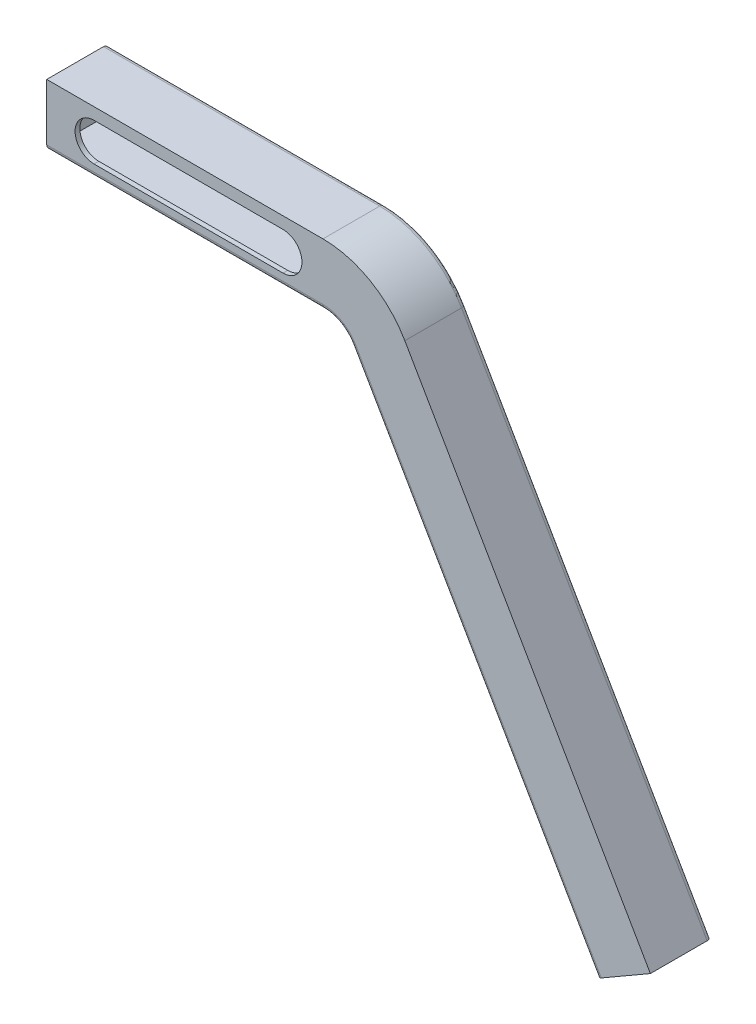
from build123d import *

# Parameters (mm, degrees)
BOSS_EXTRUDE1_DEPTH = 33.02
SHELL1_T            = -2.54
CUT_EXTRUDE1_REACH  = 409.111
SKETCH2_W           = 27.94
SKETCH2_H           = 27.94
CUT_EXTRUDE2_DEPTH  = 2.54
CUT_EXTRUDE3_REACH  = 303.28
CUT_EXTRUDE4_REACH  = 303.28
SKETCH6_R           = 6.35
CUT_EXTRUDE5_REACH  = 303.28
SKETCH7_R           = 6.35
SKETCH8_W           = 27.94
SKETCH8_H           = 27.94
BOSS_EXTRUDE2_DEPTH = 2.54
FILLET1_R           = 2.54


with BuildPart() as part:
    # Sketch1 → Boss-Extrude1 (new body)
    with BuildSketch(Plane.XY):
        with BuildLine():
            Line((-172.046968374, 25.4), (-23.576362049, 25.4))
            ThreePointArc((-23.576362049, 25.4), (1.823637951, 18.594090512), (20.417728463, 0))
            Line((20.417728463, 0), (152.4, -228.6))
            Line((152.4, -228.6), (123.803841167, -245.11))
            Line((123.803841167, -245.11), (-8.17843037, -16.51))
            ThreePointArc((-8.17843037, -16.51), (-14.686362049, -10.002068321), (-23.576362049, -7.62))
            Line((-23.576362049, -7.62), (-172.046968374, -7.62))
            Line((-172.046968374, -7.62), (-172.046968374, 25.4))
        make_face()
    extrude(amount=BOSS_EXTRUDE1_DEPTH)

    # Shell1
    shell1_openings = [part.faces().sort_by_distance(p)[0] for p in [
        (-172.046968374, 8.89, 16.51),
    ]]
    offset(amount=SHELL1_T, openings=shell1_openings, kind=Kind.INTERSECTION)

    # Sketch2 → Cut-Extrude1 (cut, up to next)
    with BuildSketch(Plane(origin=(137.086703653, -237.441135768, 0), x_dir=(0.8660254037844406, 0.4999999999999967, 0), z_dir=(0.4999999999999967, -0.8660254037844406, 0)), mode=Mode.PRIVATE) as cut_extrude1_sk1:
        with Locations((1.172271537, 16.51)):
            Rectangle(SKETCH2_W, SKETCH2_H)
    cut_extrude1_tool1 = extrude(cut_extrude1_sk1.sketch, amount=-CUT_EXTRUDE1_REACH, mode=Mode.PRIVATE) & part.part
    add(cut_extrude1_tool1.solids().sort_by_distance((138.101921, -236.855, 16.51))[0], mode=Mode.SUBTRACT)

    # Sketch3 → Cut-Extrude2 (cut)
    with BuildSketch(Plane.XY.offset(33.02)):
        with BuildLine():
            Line((-146.646968374, 19.05), (-45.046968374, 19.05))
            ThreePointArc((-45.046968374, 19.05), (-34.886968374, 8.89), (-45.046968374, -1.27))
            Line((-45.046968374, -1.27), (-50.126968374, -1.27))
            Line((-50.126968374, -1.27), (-146.646968374, -1.27))
            ThreePointArc((-146.646968374, -1.27), (-156.806968374, 8.89), (-146.646968374, 19.05))
        make_face()
    extrude(amount=-CUT_EXTRUDE2_DEPTH, mode=Mode.SUBTRACT)

    # Sketch4 → Cut-Extrude3 (cut, up to next)
    with BuildSketch(Plane(origin=(0, 0, 0), x_dir=(-1, 0, 0), z_dir=(0, 0, -1)), mode=Mode.PRIVATE) as cut_extrude3_sk1:
        with BuildLine():
            Line((45.046968374, -1.27), (146.646968374, -1.27))
            ThreePointArc((146.646968374, -1.27), (156.806968374, 8.89), (146.646968374, 19.05))
            Line((146.646968374, 19.05), (45.046968374, 19.05))
            ThreePointArc((45.046968374, 19.05), (34.886968374, 8.89), (45.046968374, -1.27))
        make_face()
    cut_extrude3_tool1 = extrude(cut_extrude3_sk1.sketch, amount=-CUT_EXTRUDE3_REACH, mode=Mode.PRIVATE) & part.part
    add(cut_extrude3_tool1.solids().sort_by_distance((-95.846968, 8.89, 0))[0], mode=Mode.SUBTRACT)

    # Sketch6 → Cut-Extrude4 (cut, up to next)
    with BuildSketch(Plane(origin=(0, 0, 0), x_dir=(-1, 0, 0), z_dir=(0, 0, -1)), mode=Mode.PRIVATE) as cut_extrude4_sk1:
        with Locations((-116.511920584, -199.460023065)):
            Circle(SKETCH6_R)
    cut_extrude4_tool1 = extrude(cut_extrude4_sk1.sketch, amount=-CUT_EXTRUDE4_REACH, mode=Mode.PRIVATE) & part.part
    # Sketch6 → Cut-Extrude4 (cut, up to next)
    with BuildSketch(Plane(origin=(0, 0, 0), x_dir=(-1, 0, 0), z_dir=(0, 0, -1)), mode=Mode.PRIVATE) as cut_extrude4_sk2:
        with Locations((-107.621920584, -184.062091385)):
            Circle(SKETCH6_R)
    cut_extrude4_tool2 = extrude(cut_extrude4_sk2.sketch, amount=-CUT_EXTRUDE4_REACH, mode=Mode.PRIVATE) & part.part
    # Sketch6 → Cut-Extrude4 (cut, up to next)
    with BuildSketch(Plane(origin=(0, 0, 0), x_dir=(-1, 0, 0), z_dir=(0, 0, -1)), mode=Mode.PRIVATE) as cut_extrude4_sk3:
        with Locations((-98.731920584, -168.664159706)):
            Circle(SKETCH6_R)
    cut_extrude4_tool3 = extrude(cut_extrude4_sk3.sketch, amount=-CUT_EXTRUDE4_REACH, mode=Mode.PRIVATE) & part.part
    # Sketch6 → Cut-Extrude4 (cut, up to next)
    with BuildSketch(Plane(origin=(0, 0, 0), x_dir=(-1, 0, 0), z_dir=(0, 0, -1)), mode=Mode.PRIVATE) as cut_extrude4_sk4:
        with Locations((-89.841920584, -153.266228027)):
            Circle(SKETCH6_R)
    cut_extrude4_tool4 = extrude(cut_extrude4_sk4.sketch, amount=-CUT_EXTRUDE4_REACH, mode=Mode.PRIVATE) & part.part
    add(cut_extrude4_tool1.solids().sort_by_distance((116.511921, -199.460023, 0))[0], mode=Mode.SUBTRACT)
    add(cut_extrude4_tool2.solids().sort_by_distance((107.621921, -184.062091, 0))[0], mode=Mode.SUBTRACT)
    add(cut_extrude4_tool3.solids().sort_by_distance((98.731921, -168.66416, 0))[0], mode=Mode.SUBTRACT)
    add(cut_extrude4_tool4.solids().sort_by_distance((89.841921, -153.266228, 0))[0], mode=Mode.SUBTRACT)

    # Sketch7 → Cut-Extrude5 (cut, up to next)
    with BuildSketch(Plane(origin=(0, 0, 0), x_dir=(-1, 0, 0), z_dir=(0, 0, -1)), mode=Mode.PRIVATE) as cut_extrude5_sk1:
        with Locations((-125.401920584, -214.857954744)):
            Circle(SKETCH7_R)
    cut_extrude5_tool1 = extrude(cut_extrude5_sk1.sketch, amount=-CUT_EXTRUDE5_REACH, mode=Mode.PRIVATE) & part.part
    add(cut_extrude5_tool1.solids().sort_by_distance((125.401921, -214.857955, 0))[0], mode=Mode.SUBTRACT)

    # Sketch8 → Boss-Extrude2 (add)
    with BuildSketch(Plane.ZY.offset(172.046968374)):
        with Locations((16.51, 8.89)):
            Rectangle(SKETCH8_W, SKETCH8_H)
    extrude(amount=-BOSS_EXTRUDE2_DEPTH)

    # Fillet1
    fillet1_edges = [part.edges().sort_by_distance(p)[0] for p in [
        (57.812705399, -130.81, 0),
        (-14.686362049, -10.002068321, 0),
        (-97.811665212, -7.62, 0),
        (-14.686362049, -10.002068321, 33.02),
        (57.812705399, -130.81, 33.02),
        (84.209159706, -115.57, 30.48),
        (0.553637951, 16.394385987, 30.48),
        (-96.541665212, 22.86, 30.48),
        (-97.811665212, 25.4, 0),
        (-97.811665212, -7.62, 33.02),
        (1.823637951, 18.594090512, 0),
        (86.408864232, -114.3, 0),
    ]]
    fillet(fillet1_edges, radius=FILLET1_R)


solid = part.part
